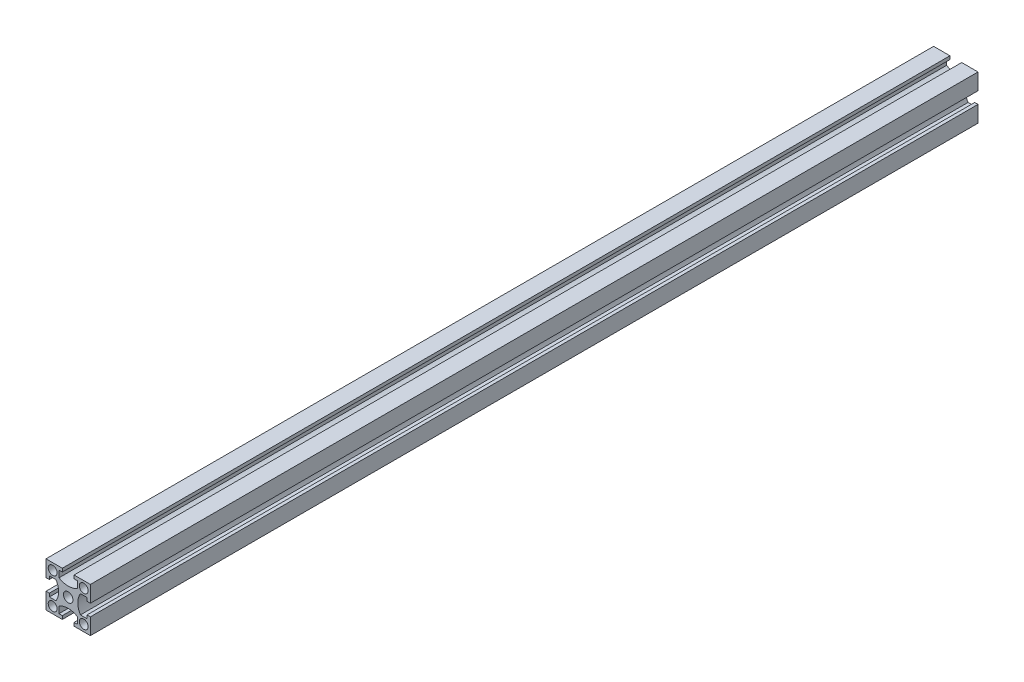
from build123d import *

# Parameters (mm, degrees)
SKETCH_1_W          = 20
SKETCH_1_H          = 20
EXTRUDE_1_DEPTH     = 400
SKETCH_2_R          = 2.15
SKETCH_2_R_2        = 2
CUT_EXTRUDE_1_DEPTH = 401.249921924


with BuildPart() as part:
    # 스케치1 → 보스-돌출1 (new body)
    with BuildSketch(Plane.XY):
        Rectangle(SKETCH_1_W, SKETCH_1_H)
    extrude(amount=EXTRUDE_1_DEPTH)

    # 스케치2 → 컷-돌출1 (cut, through all)
    with BuildSketch(Plane.XY.offset(400)):
        Circle(SKETCH_2_R)
        with Locations((-7, 7)):
            Circle(SKETCH_2_R_2)
        with Locations((7, 7)):
            Circle(SKETCH_2_R_2)
        with Locations((7, -7)):
            Circle(SKETCH_2_R_2)
        with Locations((-7, -7)):
            Circle(SKETCH_2_R_2)
        with BuildLine():
            Line((-2.65, 10), (-2.65, 8.5))
            Line((-2.65, 8.5), (-4.15, 8.5))
            Line((-4.15, 8.5), (-4.15, 5.5))
            ThreePointArc((-4.15, 5.5), (0, 4.339407869), (4.15, 5.5))
            Line((4.15, 5.5), (4.15, 8.5))
            Line((4.15, 8.5), (2.65, 8.5))
            Line((2.65, 8.5), (2.65, 10))
            Line((2.65, 10), (-2.65, 10))
        make_face()
        with BuildLine():
            Line((10, 2.65), (8.5, 2.65))
            Line((8.5, 2.65), (8.5, 4.15))
            Line((8.5, 4.15), (5.5, 4.15))
            ThreePointArc((5.5, 4.15), (4.339407869, 0), (5.5, -4.15))
            Line((5.5, -4.15), (8.5, -4.15))
            Line((8.5, -4.15), (8.5, -2.65))
            Line((8.5, -2.65), (10, -2.65))
            Line((10, -2.65), (10, 2.65))
        make_face()
        with BuildLine():
            Line((2.65, -10), (2.65, -8.5))
            Line((2.65, -8.5), (4.15, -8.5))
            Line((4.15, -8.5), (4.15, -5.5))
            ThreePointArc((4.15, -5.5), (0, -4.339407869), (-4.15, -5.5))
            Line((-4.15, -5.5), (-4.15, -8.5))
            Line((-4.15, -8.5), (-2.65, -8.5))
            Line((-2.65, -8.5), (-2.65, -10))
            Line((-2.65, -10), (2.65, -10))
        make_face()
        with BuildLine():
            Line((-10, -2.65), (-8.5, -2.65))
            Line((-8.5, -2.65), (-8.5, -4.15))
            Line((-8.5, -4.15), (-5.5, -4.15))
            ThreePointArc((-5.5, -4.15), (-4.339407869, 0), (-5.5, 4.15))
            Line((-5.5, 4.15), (-8.5, 4.15))
            Line((-8.5, 4.15), (-8.5, 2.65))
            Line((-8.5, 2.65), (-10, 2.65))
            Line((-10, 2.65), (-10, -2.65))
        make_face()
    extrude(amount=-CUT_EXTRUDE_1_DEPTH, mode=Mode.SUBTRACT)


solid = part.part
